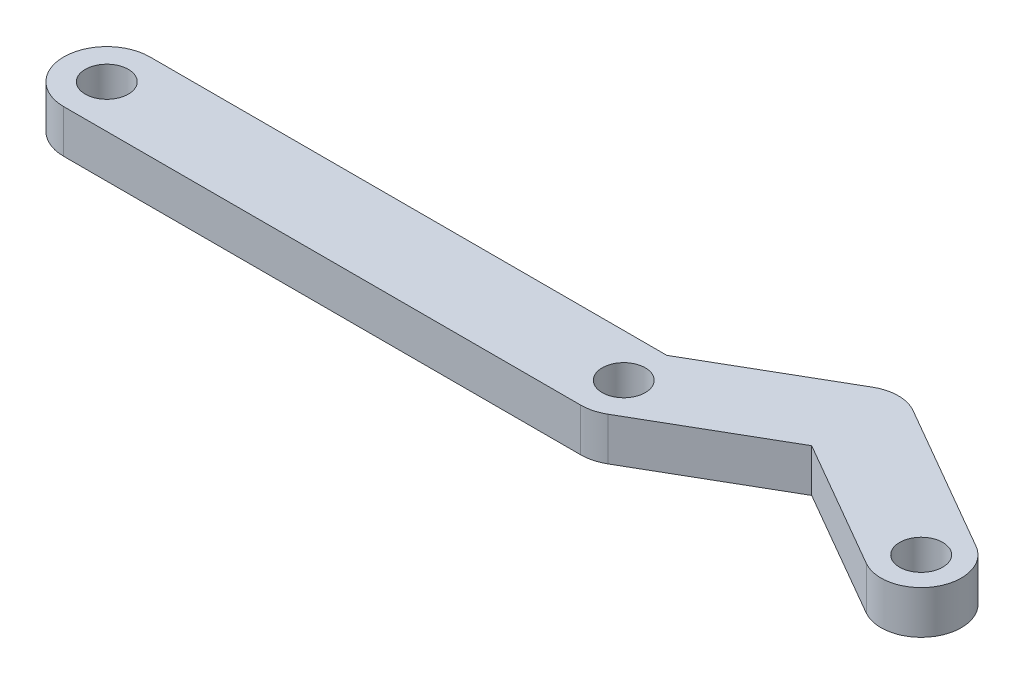
from build123d import *

# Parameters (mm, degrees)
SKETCH1_R           = 3.175
BOSS_EXTRUDE1_DEPTH = 6.35
BOSS_EXTRUDE2_START = -6.35
BOSS_EXTRUDE2_DEPTH = 6.35
BOSS_EXTRUDE3_START = -6.35
SKETCH3_R           = 3.175
BOSS_EXTRUDE3_DEPTH = 6.35


with BuildPart() as part:
    # Sketch1 → Boss-Extrude1 (new body)
    with BuildSketch(Plane(origin=(0, 0, 0), x_dir=(1, 0, 0), z_dir=(0, 1, 0))):
        with BuildLine():
            Line((0, -6.35), (-76.2, -6.35))
            ThreePointArc((-76.2, -6.35), (-82.55, 0), (-76.2, 6.35))
            Line((-76.2, 6.35), (0, 6.35))
            ThreePointArc((0, 6.35), (6.35, 0), (0, -6.35))
        make_face()
        with Locations(Location((-76.2, 0, 0), (0, 0, 270))):
            Circle(SKETCH1_R, mode=Mode.SUBTRACT)
        with Locations(Location((0, 0, 0), (0, 0, 270))):
            Circle(SKETCH1_R, mode=Mode.SUBTRACT)
    extrude(amount=BOSS_EXTRUDE1_DEPTH)

    # Sketch2 → Boss-Extrude2 (add)
    with BuildSketch(Plane(origin=(0, 6.35, 0), x_dir=(1, 0, 0), z_dir=(0, 1, 0)).offset(BOSS_EXTRUDE2_START)):
        with BuildLine():
            Line((3.175, -5.499261314), (25.172045256, 7.200738686))
            ThreePointArc((25.172045256, 7.200738686), (27.340610585, 15.293934671), (19.247414599, 17.4625))
            Line((19.247414599, 17.4625), (0, 6.35))
            ThreePointArc((0, 6.35), (6.133628997, 1.643500936), (3.175, -5.499261314))
        make_face()
    extrude(amount=BOSS_EXTRUDE2_DEPTH)

    # Sketch3 → Boss-Extrude3 (add)
    with BuildSketch(Plane(origin=(0, 6.35, 0), x_dir=(1, 0, 0), z_dir=(0, 1, 0)).offset(BOSS_EXTRUDE3_START)):
        with BuildLine():
            Line((25.172045256, 17.4625), (47.169090512, 4.7625))
            ThreePointArc((47.169090512, 4.7625), (49.337655841, -3.330695986), (41.244459855, -5.499261314))
            Line((41.244459855, -5.499261314), (22.209729928, 5.490445134))
            Line((22.209729928, 5.490445134), (25.172045256, 7.200738686))
            ThreePointArc((25.172045256, 7.200738686), (28.134360585, 12.331619343), (25.172045256, 17.4625))
        make_face()
        with Locations(Location((44.206775184, -0.368380657, 0), (0, 0, 270))):
            Circle(SKETCH3_R, mode=Mode.SUBTRACT)
    extrude(amount=BOSS_EXTRUDE3_DEPTH)


solid = part.part
